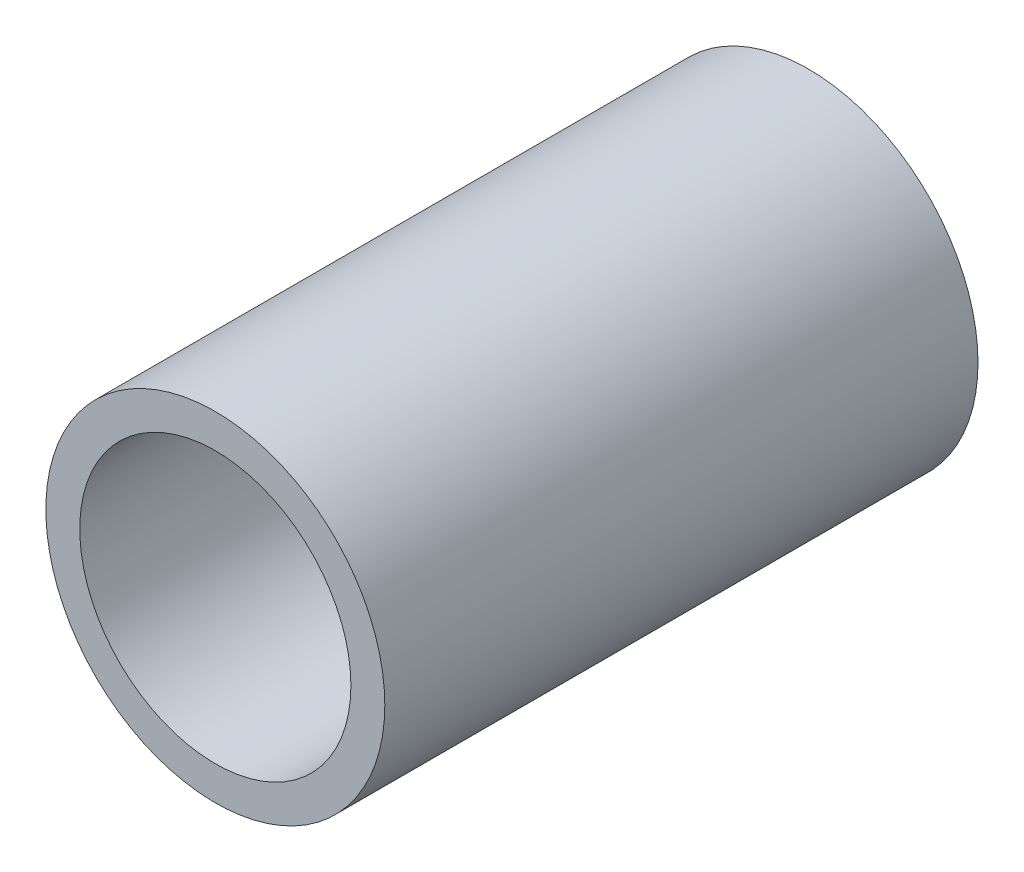
from build123d import *

# Parameters (mm, degrees)
SKETCH1_R           = 5
SKETCH1_R_2         = 4
BOSS_EXTRUDE1_DEPTH = 17.5


with BuildPart() as part:
    # Sketch1 → Boss-Extrude1 (new body)
    with BuildSketch(Plane.XY):
        Circle(SKETCH1_R)
        Circle(SKETCH1_R_2, mode=Mode.SUBTRACT)
    extrude(amount=BOSS_EXTRUDE1_DEPTH)


solid = part.part
